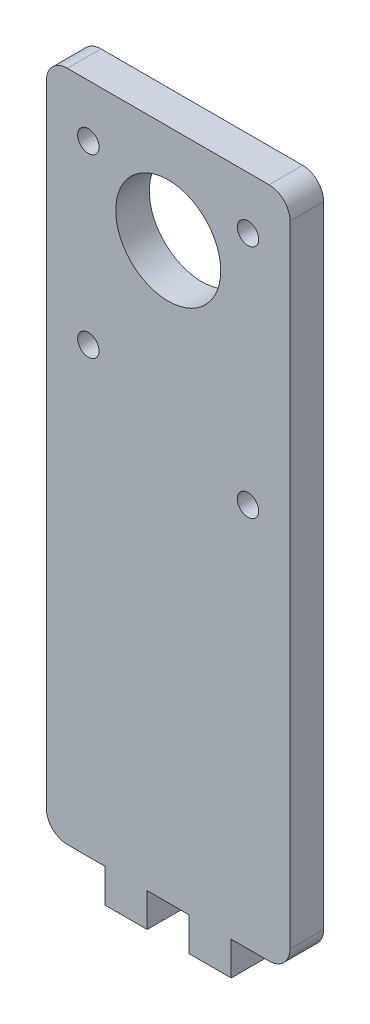
from build123d import *

# Parameters (mm, degrees)
SKETCH1_W           = 58
SKETCH1_H           = 160
BOSS_EXTRUDE1_DEPTH = 8
SKETCH2_R           = 2.55
SKETCH2_R_2         = 12.5
CUT_EXTRUDE1_DEPTH  = 86.469292731
SKETCH6_W           = 10
SKETCH6_H           = 8
BOSS_EXTRUDE3_DEPTH = 8
FILLET2_R           = 5


with BuildPart() as part:
    # Sketch1 → Boss-Extrude1 (new body)
    with BuildSketch(Plane.XY):
        Rectangle(SKETCH1_W, SKETCH1_H)
    extrude(amount=BOSS_EXTRUDE1_DEPTH)

    # Sketch2 → Cut-Extrude1 (cut, through all)
    with BuildSketch(Plane.XY.offset(8)):
        with Locations((-19, 67.5)):
            Circle(SKETCH2_R)
        with Locations((19, 67.5)):
            Circle(SKETCH2_R)
        with Locations((-19, 25.5)):
            Circle(SKETCH2_R)
        with Locations((19, 11.5)):
            Circle(SKETCH2_R)
        with Locations((0, 56.5)):
            Circle(SKETCH2_R_2)
    extrude(amount=-CUT_EXTRUDE1_DEPTH, mode=Mode.SUBTRACT)

    # Sketch6 → Boss-Extrude3 (add)
    with BuildSketch(Plane.XZ.offset(80)):
        with Locations((-10, 4)):
            Rectangle(SKETCH6_W, SKETCH6_H)
        with Locations((10, 4)):
            Rectangle(SKETCH6_W, SKETCH6_H)
    extrude(amount=BOSS_EXTRUDE3_DEPTH)

    # Fillet2
    fillet2_edges = [part.edges().sort_by_distance(p)[0] for p in [
        (29, 80, 4),
        (-29, 80, 4),
        (29, -80, 4),
        (-29, -80, 4),
    ]]
    fillet(fillet2_edges, radius=FILLET2_R)


solid = part.part
